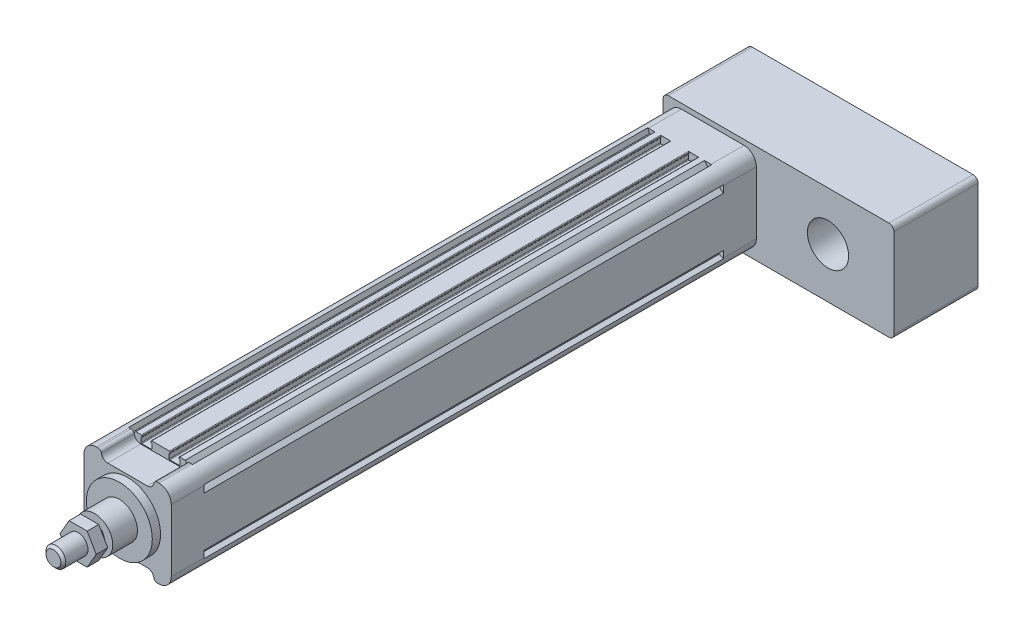
from build123d import *

# Parameters (mm, degrees)
SKETCH_1_R                  = 2.1
EXTRUDE_1_DEPTH             = 315
EXTRUDE_2_DEPTH             = 20
SKETCH_7_R                  = 20
EXTRUDE_3_DEPTH             = 5
SKETCH_9_R                  = 11
EXTRUDE_4_DEPTH             = 15
SKETCH_10_R                 = 6
EXTRUDE_5_DEPTH             = 25
EXTRUDE_START               = 20
EXTRUDE_6_DEPTH             = 20
EXTRUDE_7_DEPTH             = 51
SKETCH_13_R                 = 12.5
CUT_EXTRUDE_2_DEPTH         = 30
PATTERN_LINEAR_1_COUNT      = 2
PATTERN_LINEAR_1_PITCH      = 38
PATTERN_LINEAR_1_COUNT_DIR2 = 2
PATTERN_LINEAR_1_PITCH_DIR2 = 38
HOLE_WIZARD_M6_2_D          = 5
HOLE_WIZARD_M6_2_DEPTH      = 15
HOLE_WIZARD_M6_2_TIP        = 1.502151548
HOLE_WIZARD_M6_3_D          = 5
HOLE_WIZARD_M6_3_DEPTH      = 15
HOLE_WIZARD_M6_3_TIP        = 1.502151548
HOLE_WIZARD_M6_4_D          = 5
HOLE_WIZARD_M6_4_DEPTH      = 15
HOLE_WIZARD_M6_4_TIP        = 1.502151548
CHAMFER_1_SIZE              = 1.5
EXTRUDE_START_2             = 3
EXTRUDE_8_DEPTH             = 7


with BuildPart() as part:
    # 草图1 → 凸台-拉伸1 (new body)
    with BuildSketch(Plane.XY):
        with BuildLine():
            Line((-18.2, 24), (-19.443439638, 26.486879276))
            ThreePointArc((-19.443439638, 26.486879276), (-24.303300859, 24.303300859), (-26.486879276, 19.443439638))
            Line((-26.486879276, 19.443439638), (-24, 18.2))
            Line((-24, 18.2), (-24, 17.1))
            Line((-24, 17.1), (-26.5, 15))
            Line((-26.5, 15), (-26.5, -15))
            Line((-26.5, -15), (-24, -17.1))
            Line((-24, -17.1), (-24, -18.2))
            Line((-24, -18.2), (-26.486879276, -19.443439638))
            ThreePointArc((-26.486879276, -19.443439638), (-24.303300859, -24.303300859), (-19.443439638, -26.486879276))
            Line((-19.443439638, -26.486879276), (-18.2, -24))
            Line((-18.2, -24), (-17.1, -24))
            Line((-17.1, -24), (-15, -26.5))
            Line((-15, -26.5), (-11.65, -26.5))
            ThreePointArc((-11.65, -26.5), (-11.367157288, -26.382842712), (-11.25, -26.1))
            Line((-11.25, -26.1), (-11.25, -25.6))
            ThreePointArc((-11.25, -25.6), (-11.367157288, -25.317157288), (-11.65, -25.2))
            Line((-11.65, -25.2), (-11.75, -25.2))
            Line((-11.75, -25.2), (-11.75, -22.4))
            ThreePointArc((-11.75, -22.4), (-11.632842712, -22.117157288), (-11.35, -22))
            Line((-11.35, -22), (-5.65, -22))
            ThreePointArc((-5.65, -22), (-5.367157288, -22.117157288), (-5.25, -22.4))
            Line((-5.25, -22.4), (-5.25, -25.2))
            Line((-5.25, -25.2), (-5.35, -25.2))
            ThreePointArc((-5.35, -25.2), (-5.632842712, -25.317157288), (-5.75, -25.6))
            Line((-5.75, -25.6), (-5.75, -26.1))
            ThreePointArc((-5.75, -26.1), (-5.632842712, -26.382842712), (-5.35, -26.5))
            Line((-5.35, -26.5), (5.35, -26.5))
            ThreePointArc((5.35, -26.5), (5.632842712, -26.382842712), (5.75, -26.1))
            Line((5.75, -26.1), (5.75, -25.6))
            ThreePointArc((5.75, -25.6), (5.632842712, -25.317157288), (5.35, -25.2))
            Line((5.35, -25.2), (5.25, -25.2))
            Line((5.25, -25.2), (5.25, -22.4))
            ThreePointArc((5.25, -22.4), (5.367157288, -22.117157288), (5.65, -22))
            Line((5.65, -22), (11.35, -22))
            ThreePointArc((11.35, -22), (11.632842712, -22.117157288), (11.75, -22.4))
            Line((11.75, -22.4), (11.75, -25.2))
            Line((11.75, -25.2), (11.65, -25.2))
            ThreePointArc((11.65, -25.2), (11.367157288, -25.317157288), (11.25, -25.6))
            Line((11.25, -25.6), (11.25, -26.1))
            ThreePointArc((11.25, -26.1), (11.367157288, -26.382842712), (11.65, -26.5))
            Line((11.65, -26.5), (15, -26.5))
            Line((15, -26.5), (17.1, -24))
            Line((17.1, -24), (18.2, -24))
            Line((18.2, -24), (19.443439638, -26.486879276))
            ThreePointArc((19.443439638, -26.486879276), (24.303300859, -24.303300859), (26.486879276, -19.443439638))
            Line((26.486879276, -19.443439638), (24, -18.2))
            Line((24, -18.2), (24, -17.1))
            Line((24, -17.1), (26.5, -15))
            Line((26.5, -15), (26.5, 15))
            Line((26.5, 15), (24, 17.1))
            Line((24, 17.1), (24, 18.2))
            Line((24, 18.2), (26.486879276, 19.443439638))
            ThreePointArc((26.486879276, 19.443439638), (24.303300859, 24.303300859), (19.443439638, 26.486879276))
            Line((19.443439638, 26.486879276), (18.2, 24))
            Line((18.2, 24), (17.1, 24))
            Line((17.1, 24), (15, 26.5))
            Line((15, 26.5), (11.65, 26.5))
            ThreePointArc((11.65, 26.5), (11.367157288, 26.382842712), (11.25, 26.1))
            Line((11.25, 26.1), (11.25, 25.6))
            ThreePointArc((11.25, 25.6), (11.367157288, 25.317157288), (11.65, 25.2))
            Line((11.65, 25.2), (11.75, 25.2))
            Line((11.75, 25.2), (11.75, 22.4))
            ThreePointArc((11.75, 22.4), (11.632842712, 22.117157288), (11.35, 22))
            Line((11.35, 22), (5.65, 22))
            ThreePointArc((5.65, 22), (5.367157288, 22.117157288), (5.25, 22.4))
            Line((5.25, 22.4), (5.25, 25.2))
            Line((5.25, 25.2), (5.35, 25.2))
            ThreePointArc((5.35, 25.2), (5.632842712, 25.317157288), (5.75, 25.6))
            Line((5.75, 25.6), (5.75, 26.1))
            ThreePointArc((5.75, 26.1), (5.632842712, 26.382842712), (5.35, 26.5))
            Line((5.35, 26.5), (-5.35, 26.5))
            ThreePointArc((-5.35, 26.5), (-5.632842712, 26.382842712), (-5.75, 26.1))
            Line((-5.75, 26.1), (-5.75, 25.6))
            ThreePointArc((-5.75, 25.6), (-5.632842712, 25.317157288), (-5.35, 25.2))
            Line((-5.35, 25.2), (-5.25, 25.2))
            Line((-5.25, 25.2), (-5.25, 22.4))
            ThreePointArc((-5.25, 22.4), (-5.367157288, 22.117157288), (-5.65, 22))
            Line((-5.65, 22), (-11.35, 22))
            ThreePointArc((-11.35, 22), (-11.632842712, 22.117157288), (-11.75, 22.4))
            Line((-11.75, 22.4), (-11.75, 25.2))
            Line((-11.75, 25.2), (-11.65, 25.2))
            ThreePointArc((-11.65, 25.2), (-11.367157288, 25.317157288), (-11.25, 25.6))
            Line((-11.25, 25.6), (-11.25, 26.1))
            ThreePointArc((-11.25, 26.1), (-11.367157288, 26.382842712), (-11.65, 26.5))
            Line((-11.65, 26.5), (-15, 26.5))
            Line((-15, 26.5), (-17.1, 24))
            Line((-17.1, 24), (-18.2, 24))
        make_face()
        with Locations((19, 19)):
            Circle(SKETCH_1_R, mode=Mode.SUBTRACT)
        with Locations((19, -19)):
            Circle(SKETCH_1_R, mode=Mode.SUBTRACT)
        with Locations((-19, -19)):
            Circle(SKETCH_1_R, mode=Mode.SUBTRACT)
        with Locations((-19, 19)):
            Circle(SKETCH_1_R, mode=Mode.SUBTRACT)
        with BuildLine():
            Line((19.773719933, 3), (23.3, 3))
            Line((23.3, 3), (23.3, -3))
            Line((23.3, -3), (19.773719933, -3))
            ThreePointArc((19.773719933, -3), (0, -20), (-19.773719933, -3))
            Line((-19.773719933, -3), (-23.3, -3))
            Line((-23.3, -3), (-23.3, 3))
            Line((-23.3, 3), (-19.773719933, 3))
            ThreePointArc((-19.773719933, 3), (0, 20), (19.773719933, 3))
        make_face(mode=Mode.SUBTRACT)
    extrude(amount=EXTRUDE_1_DEPTH)

    # 草图6 → 凸台-拉伸2 (add)
    with BuildSketch(Plane.XY.offset(315)):
        with BuildLine():
            Line((-26.5, -19), (-26.5, 19))
            ThreePointArc((-26.5, 19), (-24.303300859, 24.303300859), (-19, 26.5))
            Line((-19, 26.5), (-17.916079783, 26.5))
            ThreePointArc((-17.916079783, 26.5), (-16.625085334, 26.027525232), (-15.944053189, 24.833333333))
            ThreePointArc((-15.944053189, 24.833333333), (-14.581988897, 22.444949537), (-12, 21.5))
            Line((-12, 21.5), (12, 21.5))
            ThreePointArc((12, 21.5), (14.581988897, 22.444949537), (15.944053189, 24.833333333))
            ThreePointArc((15.944053189, 24.833333333), (16.625085334, 26.027525232), (17.916079783, 26.5))
            Line((17.916079783, 26.5), (19, 26.5))
            ThreePointArc((19, 26.5), (24.303300859, 24.303300859), (26.5, 19))
            Line((26.5, 19), (26.5, -19))
            ThreePointArc((26.5, -19), (24.303300859, -24.303300859), (19, -26.5))
            Line((19, -26.5), (17.916079783, -26.5))
            ThreePointArc((17.916079783, -26.5), (16.625085334, -26.027525232), (15.944053189, -24.833333333))
            ThreePointArc((15.944053189, -24.833333333), (14.581988897, -22.444949537), (12, -21.5))
            Line((12, -21.5), (-12, -21.5))
            ThreePointArc((-12, -21.5), (-14.581988897, -22.444949537), (-15.944053189, -24.833333333))
            ThreePointArc((-15.944053189, -24.833333333), (-16.625085334, -26.027525232), (-17.916079783, -26.5))
            Line((-17.916079783, -26.5), (-19, -26.5))
            ThreePointArc((-19, -26.5), (-24.303300859, -24.303300859), (-26.5, -19))
        make_face()
    extrude(amount=EXTRUDE_2_DEPTH)

    # 草图7 → 凸台-拉伸3 (add)
    with BuildSketch(Plane.XY.offset(335)):
        Circle(SKETCH_7_R)
    extrude(amount=EXTRUDE_3_DEPTH)

    # 草图9 → 凸台-拉伸4 (add)
    with BuildSketch(Plane.XY.offset(340)):
        Circle(SKETCH_9_R)
    extrude(amount=EXTRUDE_4_DEPTH)

    # 草图10 → 凸台-拉伸5 (add)
    with BuildSketch(Plane.XY.offset(355)):
        Circle(SKETCH_10_R)
    extrude(amount=EXTRUDE_5_DEPTH)

    # 草图11 → 凸台-拉伸6 (add)
    with BuildSketch(Plane(origin=(0, 0, 0), x_dir=(-1, 0, 0), z_dir=(0, 0, -1)).offset(EXTRUDE_START)):
        with BuildLine():
            Line((-19, -26.5), (19, -26.5))
            ThreePointArc((19, -26.5), (24.303300859, -24.303300859), (26.5, -19))
            Line((26.5, -19), (26.5, 19))
            ThreePointArc((26.5, 19), (24.303300859, 24.303300859), (19, 26.5))
            Line((19, 26.5), (-19, 26.5))
            ThreePointArc((-19, 26.5), (-24.303300859, 24.303300859), (-26.5, 19))
            Line((-26.5, 19), (-26.5, -19))
            ThreePointArc((-26.5, -19), (-24.303300859, -24.303300859), (-19, -26.5))
        make_face()
    extrude(amount=-EXTRUDE_6_DEPTH)

    # 草图12 → 凸台-拉伸7 (add)
    with BuildSketch(Plane(origin=(0, 0, -20), x_dir=(-1, 0, 0), z_dir=(0, 0, -1))):
        with BuildLine():
            Line((-107, -30.404162038), (27, -30.404162038))
            ThreePointArc((27, -30.404162038), (29.121320344, -29.525482382), (30, -27.404162038))
            Line((30, -27.404162038), (30, 26.595837962))
            ThreePointArc((30, 26.595837962), (29.121320344, 28.717158305), (27, 29.595837962))
            Line((27, 29.595837962), (-107, 29.595837962))
            ThreePointArc((-107, 29.595837962), (-109.121320344, 28.717158305), (-110, 26.595837962))
            Line((-110, 26.595837962), (-110, -27.404162038))
            ThreePointArc((-110, -27.404162038), (-109.121320344, -29.525482382), (-107, -30.404162038))
        make_face()
    extrude(amount=EXTRUDE_7_DEPTH)

    # 草图13 → 切除-拉伸2 (cut)
    with BuildSketch(Plane.XY.offset(-20)):
        with Locations((70, 0)):
            Circle(SKETCH_13_R)
    extrude(amount=-CUT_EXTRUDE_2_DEPTH, mode=Mode.SUBTRACT)

    # 草图15 → M6 螺纹孔1 (revolve, cut)
    with BuildSketch(Plane(origin=(-19, -19, -71), x_dir=(0, 1, 0), z_dir=(1, 0, 0))):
        Polygon((0, 0), (0, 16.502151548), (2.5, 15), (2.5, 0), align=None)
    hole_wizard_m6_1 = revolve(axis=Axis((-19, -19, -77.35), (0, 0, 1)), mode=Mode.SUBTRACT)

    # 阵列(线性)1: Hole Wizard M6 _1 2 × 2
    with Locations(*[(j * PATTERN_LINEAR_1_PITCH_DIR2, i * PATTERN_LINEAR_1_PITCH, 0) for i in range(PATTERN_LINEAR_1_COUNT) for j in range(PATTERN_LINEAR_1_COUNT_DIR2) if (i, j) != (0, 0)]):
        add(hole_wizard_m6_1, mode=Mode.SUBTRACT)

    # M6 螺纹孔2
    with Locations(Plane(origin=(0, 0, -71), x_dir=(-1, 0, 0), z_dir=(0, 0, -1))):
        with Locations((-84, -19), (-84, 19)):
            Hole(HOLE_WIZARD_M6_2_D / 2, depth=HOLE_WIZARD_M6_2_DEPTH)
            with Locations((0, 0, -(HOLE_WIZARD_M6_2_DEPTH + HOLE_WIZARD_M6_2_TIP / 2))):  # 118° drill point
                Cone(0, HOLE_WIZARD_M6_2_D / 2, HOLE_WIZARD_M6_2_TIP, mode=Mode.SUBTRACT)

    # M6 螺纹孔3
    with Locations(Plane.ZY.offset(26.5)):
        with Locations((325, 11), (325, -11)):
            Hole(HOLE_WIZARD_M6_3_D / 2, depth=HOLE_WIZARD_M6_3_DEPTH)
            with Locations((0, 0, -(HOLE_WIZARD_M6_3_DEPTH + HOLE_WIZARD_M6_3_TIP / 2))):  # 118° drill point
                Cone(0, HOLE_WIZARD_M6_3_D / 2, HOLE_WIZARD_M6_3_TIP, mode=Mode.SUBTRACT)

    # M6 螺纹孔4
    with Locations(Plane.ZY.offset(26.5)):
        with Locations((-10, 11), (-10, -11)):
            Hole(HOLE_WIZARD_M6_4_D / 2, depth=HOLE_WIZARD_M6_4_DEPTH)
            with Locations((0, 0, -(HOLE_WIZARD_M6_4_DEPTH + HOLE_WIZARD_M6_4_TIP / 2))):  # 118° drill point
                Cone(0, HOLE_WIZARD_M6_4_D / 2, HOLE_WIZARD_M6_4_TIP, mode=Mode.SUBTRACT)

    # 倒角1
    chamfer_1_edges = [part.edges().sort_by_distance(p)[0] for p in [
        (-6, 0, 380),
    ]]
    chamfer(chamfer_1_edges, length=CHAMFER_1_SIZE)

    # 草图23 → 凸台-拉伸8 (add)
    with BuildSketch(Plane.XY.offset(355).offset(EXTRUDE_START_2)):
        Polygon((10.969655115, 0), (5.484827557, 9.5), (-5.484827557, 9.5), (-10.969655115, 0), (-5.484827557, -9.5), (5.484827557, -9.5), align=None)
    extrude(amount=EXTRUDE_8_DEPTH)


solid = part.part
